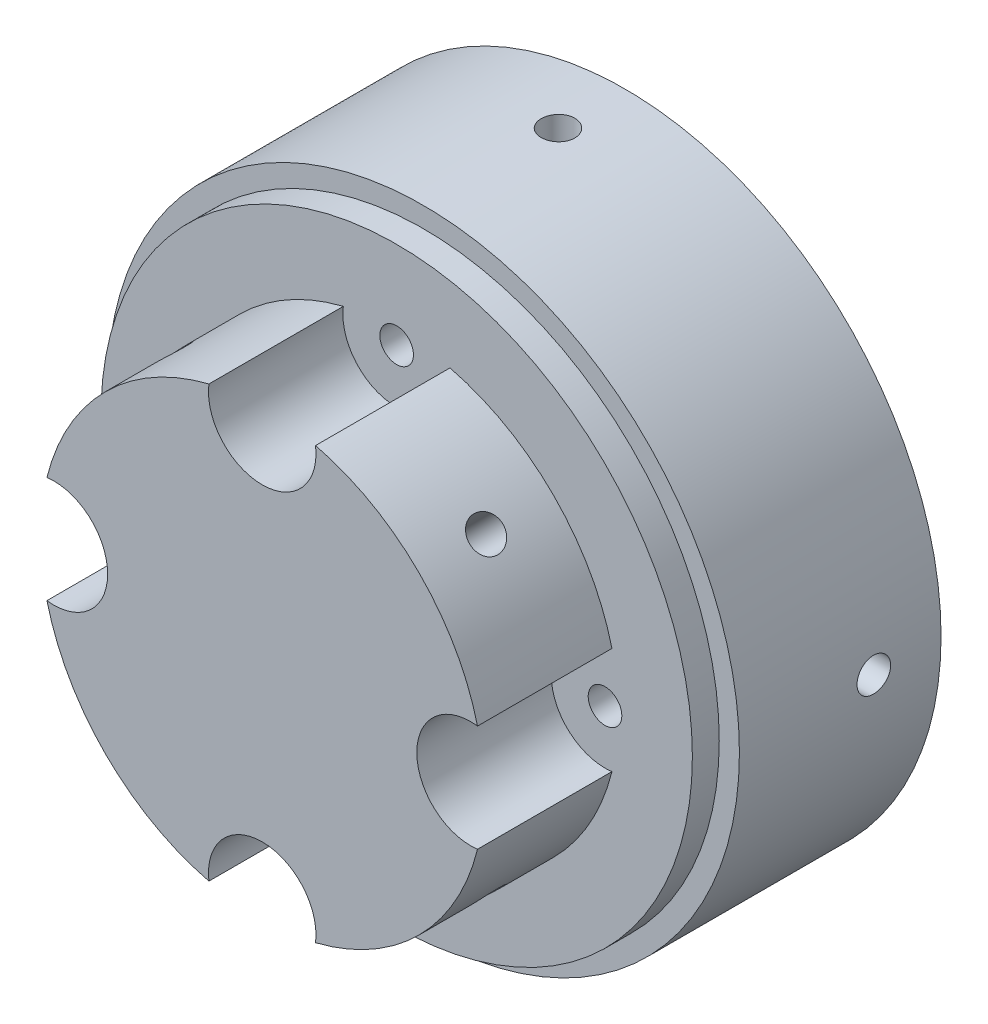
from build123d import *

# Parameters (mm, degrees)
SKETCH_1_R               = 23.5
SKETCH_1_R_2             = 21
EXTRUDE_1_DEPTH          = 15
SKETCH_2_R               = 1.25
CUT_EXTRUDE_1_DEPTH      = 27
PATTERN_CIRCULAR_1_COUNT = 4
SKETCH_3_R               = 22
EXTRUDE_2_DEPTH          = 2
SKETCH_4_R               = 1.25
CUT_EXTRUDE_2_DEPTH      = 2
SKETCH_5_R               = 16.5
EXTRUDE_4_DEPTH          = 10
SKETCH_6_R               = 4
CUT_EXTRUDE_5_DEPTH      = 10
SKETCH_8_R               = 1.25
CUT_EXTRUDE_6_DEPTH      = 43
PATTERN_CIRCULAR_2_COUNT = 4


with BuildPart() as part:
    # 草图1 → 凸台-拉伸1 (new body)
    with BuildSketch(Plane.XY):
        Circle(SKETCH_1_R)
        Circle(SKETCH_1_R_2, mode=Mode.SUBTRACT)
    extrude(amount=EXTRUDE_1_DEPTH)

    # 草图2 → 切除-拉伸1 (cut, symmetric)
    with BuildSketch(Plane(origin=(0, 0, 0), x_dir=(0, 0, -1), z_dir=(1, 0, 0))):
        with Locations((-5, 0)):
            Circle(SKETCH_2_R)
    cut_extrude_1 = extrude(amount=CUT_EXTRUDE_1_DEPTH, both=True, mode=Mode.SUBTRACT)

    # 阵列(圆周)1: 切除-拉伸1 ×4 about axis
    pattern_circular_1_axis = Axis((0, 0, 15), (0, 0, -1))
    for i in range(1, PATTERN_CIRCULAR_1_COUNT):
        add(cut_extrude_1.rotate(pattern_circular_1_axis, i * 360 / PATTERN_CIRCULAR_1_COUNT), mode=Mode.SUBTRACT)

    # 草图3 → 凸台-拉伸2 (add)
    with BuildSketch(Plane.XY.offset(15)):
        Circle(SKETCH_3_R)
    extrude(amount=EXTRUDE_2_DEPTH)

    # 草图4 → 切除-拉伸2 (cut)
    with BuildSketch(Plane.XY.offset(17)):
        with Locations((15.5, 0)):
            Circle(SKETCH_4_R)
        with Locations((0, -15.5)):
            Circle(SKETCH_4_R)
        with Locations((-15.5, 0)):
            Circle(SKETCH_4_R)
        with Locations((0, 15.5)):
            Circle(SKETCH_4_R)
    extrude(amount=-CUT_EXTRUDE_2_DEPTH, mode=Mode.SUBTRACT)

    # 草图5 → 凸台-拉伸4 (add)
    with BuildSketch(Plane.XY.offset(17)):
        with Locations(Location((0, 0, 0), (0, 0, 182.687298331))):
            Circle(SKETCH_5_R)
    extrude(amount=EXTRUDE_4_DEPTH)

    # 草图6 → 切除-拉伸5 (cut)
    with BuildSketch(Plane.XY.offset(27)):
        with Locations((0, -15.5)):
            Circle(SKETCH_6_R)
        with Locations((-15.5, 0)):
            Circle(SKETCH_6_R)
        with Locations((0, 15.5)):
            Circle(SKETCH_6_R)
        with Locations((15.5, 0)):
            Circle(SKETCH_6_R)
    extrude(amount=-CUT_EXTRUDE_5_DEPTH, mode=Mode.SUBTRACT)

    # 草图8 → 切除-拉伸6 (cut)
    with BuildSketch(Plane(origin=(11.66726189, 11.66726189, 0), x_dir=(0, 0, -1), z_dir=(0.7071067811865561, 0.7071067811865389, 0))):
        with Locations(Location((-22, 0, 0), (0, 0, 90))):
            Circle(SKETCH_8_R)
    cut_extrude_6 = extrude(amount=-CUT_EXTRUDE_6_DEPTH, mode=Mode.SUBTRACT)

    # 阵列(圆周)2: 切除-拉伸6 ×4 about axis
    pattern_circular_2_axis = Axis((0, 0, 27), (0, 0, 1))
    for i in range(1, PATTERN_CIRCULAR_2_COUNT):
        add(cut_extrude_6.rotate(pattern_circular_2_axis, i * 360 / PATTERN_CIRCULAR_2_COUNT), mode=Mode.SUBTRACT)


solid = part.part
